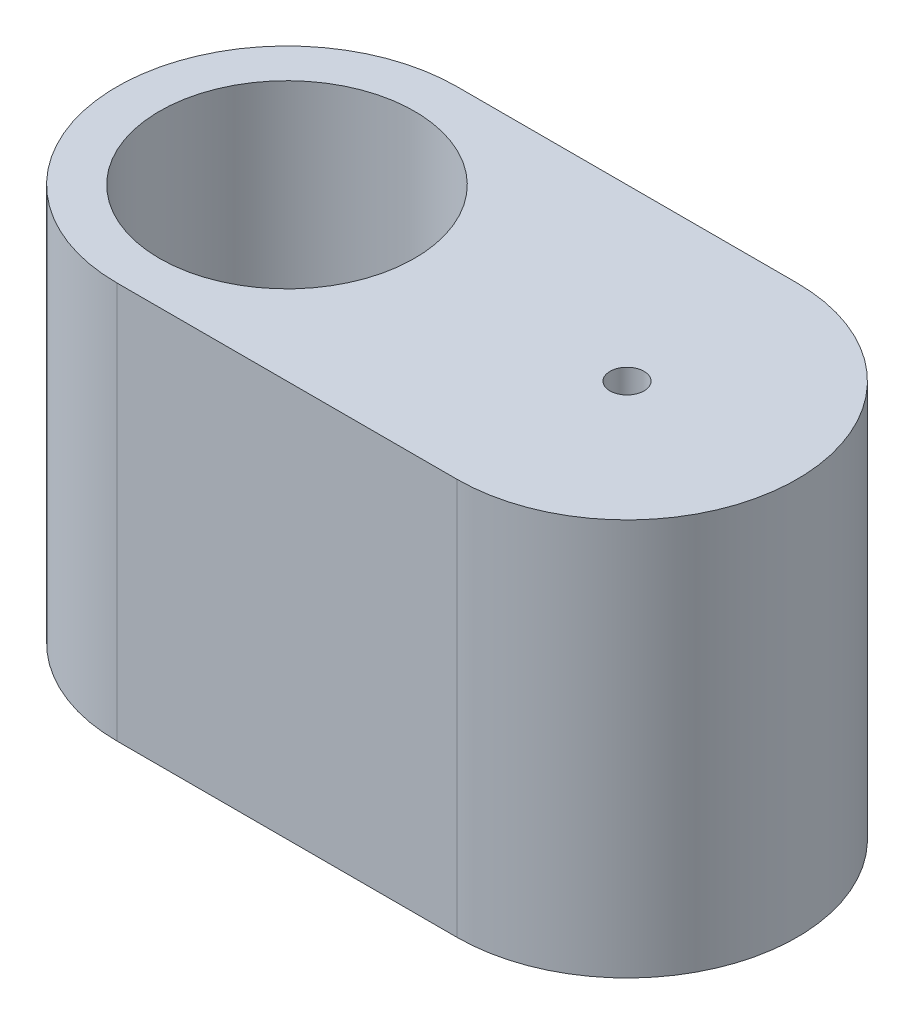
from build123d import *

# Parameters (mm, degrees)
SKETCH3_R           = 22.5
BOSS_EXTRUDE1_DEPTH = 70
SKETCH4_R           = 6
CUT_EXTRUDE1_DEPTH  = 2.5
SKETCH6_R           = 3
CUT_EXTRUDE2_DEPTH  = 6
SKETCH7_R           = 3
CUT_EXTRUDE3_DEPTH  = 118.898261226


with BuildPart() as part:
    # Sketch3 → Boss-Extrude1 (new body)
    with BuildSketch(Plane(origin=(0, 0, 0), x_dir=(1, 0, 0), z_dir=(0, 1, 0))):
        with BuildLine():
            Line((0, 30), (60, 30))
            ThreePointArc((60, 30), (90, 0), (60, -30))
            Line((60, -30), (0, -30))
            ThreePointArc((0, -30), (-30, 0), (0, 30))
        make_face()
        with Locations(Location((0, 0, 0), (0, 0, 270))):
            Circle(SKETCH3_R, mode=Mode.SUBTRACT)
    extrude(amount=BOSS_EXTRUDE1_DEPTH)

    # Sketch4 → Cut-Extrude1 (cut)
    with BuildSketch(Plane.XZ):
        with Locations(Location((60, 0, 0), (0, 0, 270))):
            Circle(SKETCH4_R)
    extrude(amount=-CUT_EXTRUDE1_DEPTH, mode=Mode.SUBTRACT)

    # Sketch6 → Cut-Extrude2 (cut)
    with BuildSketch(Plane.XZ):
        with Locations(Location((60, 0, 0), (0, 0, 270))):
            Circle(SKETCH6_R)
    extrude(amount=-CUT_EXTRUDE2_DEPTH, mode=Mode.SUBTRACT)

    # Sketch7 → Cut-Extrude3 (cut, through all)
    with BuildSketch(Plane(origin=(0, 70, 0), x_dir=(1, 0, 0), z_dir=(0, 1, 0))):
        with Locations(Location((60, 0, 0), (0, 0, 90))):
            Circle(SKETCH7_R)
    extrude(amount=-CUT_EXTRUDE3_DEPTH, mode=Mode.SUBTRACT)


solid = part.part
